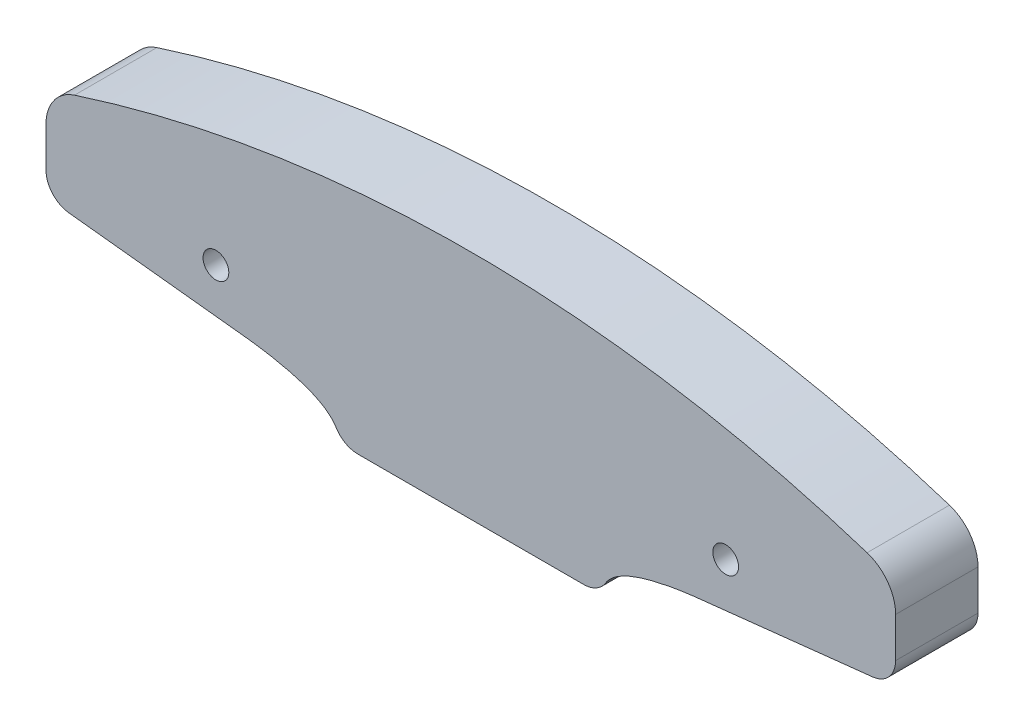
from build123d import *

# Parameters (mm, degrees)
BOSS_EXTRUDE1_DEPTH = 8
FILLET1_R           = 8
FILLET2_R           = 5
FILLET3_R           = 5
SKETCH2_R           = 2.5
CUT_EXTRUDE1_DEPTH  = 96.327068709


with BuildPart() as part:
    # Sketch1 → Boss-Extrude1 (new, symmetric)
    with BuildSketch(Plane.XY):
        with BuildLine():
            Line((0, 0), (0, 45))
            ThreePointArc((0, 45), (41.839723947, 41.475158976), (82.5, 31))
            Line((82.5, 31), (82.5, 13))
            Line((82.5, 13), (43.165682973, 8.697844187))
            add(Edge.make_bspline(
                [(25.5, 0), (25.5, 6.5), (43.165682973, 8.697844187)],
                knots=[0, 0, 0, 1, 1, 1], degree=2))
            Line((25.5, 0), (0, 0))
        make_face()
    boss_extrude1 = extrude(amount=BOSS_EXTRUDE1_DEPTH, both=True)

    # Mirror1: Boss-Extrude1 across plane
    add(boss_extrude1.mirror(Plane(origin=(0, 0, 0), x_dir=(0, 0, 1), z_dir=(1, 0, 0))))

    # Fillet1
    fillet1_edges = [part.edges().sort_by_distance(p)[0] for p in [
        (82.5, 31, 0),
        (-82.5, 31, 0),
    ]]
    fillet(fillet1_edges, radius=FILLET1_R)

    # Fillet2
    fillet2_edges = [part.edges().sort_by_distance(p)[0] for p in [
        (82.5, 13, 0),
        (-82.5, 13, 0),
    ]]
    fillet(fillet2_edges, radius=FILLET2_R)

    # Fillet3
    fillet3_edges = [part.edges().sort_by_distance(p)[0] for p in [
        (25.5, 0, 4),
        (-25.5, 0, -4),
    ]]
    fillet(fillet3_edges, radius=FILLET3_R)

    # Sketch2 → Cut-Extrude1 (cut, through all)
    with BuildSketch(Plane.XY.offset(8)):
        with Locations((49.5, 18)):
            Circle(SKETCH2_R)
    cut_extrude1 = extrude(amount=-CUT_EXTRUDE1_DEPTH, mode=Mode.SUBTRACT)

    # Mirror4: Cut-Extrude1 across plane
    add(cut_extrude1.mirror(Plane(origin=(0, 0, 0), x_dir=(0, 0, 1), z_dir=(1, 0, 0))), mode=Mode.SUBTRACT)


solid = part.part
